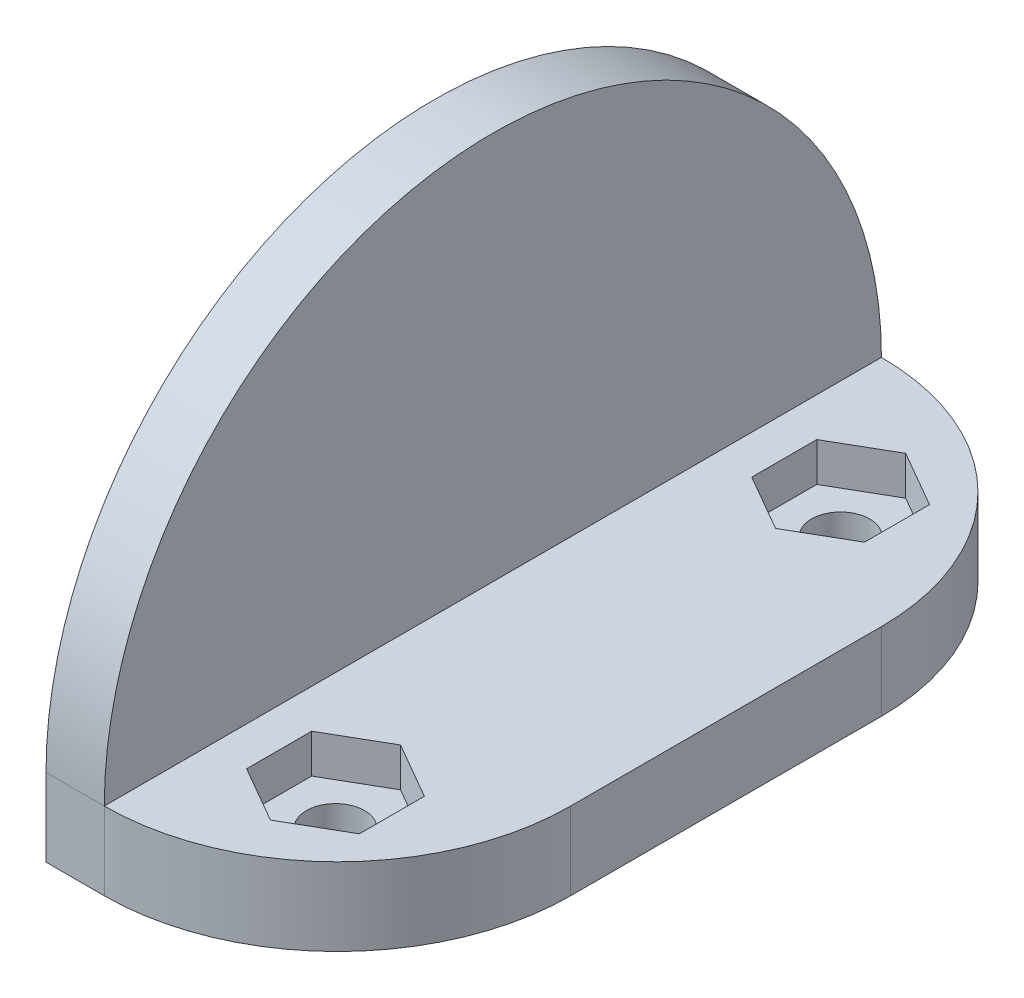
from build123d import *

# Parameters (mm, degrees)
SALIENTE_EXTRUIR1_DEPTH = 40
CORTAR_EXTRUIR4_DEPTH   = 10
CORTAR_EXTRUIR5_DEPTH   = 10
CORTAR_EXTRUIR6_DEPTH   = 2
CROQUIS8_R              = 1.5
CORTAR_EXTRUIR7_DEPTH   = 42
CROQUIS9_R              = 1.5
CORTAR_EXTRUIR8_DEPTH   = 42


with BuildPart() as part:
    # Croquis2 → Saliente-Extruir1 (new body)
    with BuildSketch(Plane.XY):
        Polygon((0, 26), (3, 26), (3, 4), (15, 4), (15, 0), (0, 0), align=None)
    extrude(amount=SALIENTE_EXTRUIR1_DEPTH)

    # Croquis6 → Cortar-Extruir4 (cut)
    with BuildSketch(Plane(origin=(3, 0, 0), x_dir=(0, 0, -1), z_dir=(1, 0, 0))):
        with BuildLine():
            Line((-40, 4), (-43.463242579, 10.305944429))
            Line((-43.463242579, 10.305944429), (-46.103119836, 28.990848346))
            Line((-46.103119836, 28.990848346), (-47.186653475, 36.660038985))
            Line((-47.186653475, 36.660038985), (8.796856155, 26.447825939))
            Line((8.796856155, 26.447825939), (6.381141064, 12.03440645))
            Line((6.381141064, 12.03440645), (0, 4))
            ThreePointArc((0, 4), (-20, 24), (-40, 4))
        make_face()
    extrude(amount=-CORTAR_EXTRUIR4_DEPTH, mode=Mode.SUBTRACT)

    # Croquis5 → Cortar-Extruir5 (cut)
    with BuildSketch(Plane(origin=(0, 4, 0), x_dir=(1, 0, 0), z_dir=(0, 1, 0))):
        with BuildLine():
            Line((15, -12), (15, -28))
            ThreePointArc((15, -28), (11.485281374, -36.485281374), (3, -40))
            Line((3, -40), (17.00840725, -44.81222058))
            Line((17.00840725, -44.81222058), (27.206798155, -5.039954665))
            Line((27.206798155, -5.039954665), (15.87267332, 7.755192399))
            Line((15.87267332, 7.755192399), (3, 0))
            ThreePointArc((3, 0), (11.485281374, -3.514718626), (15, -12))
        make_face()
    extrude(amount=-CORTAR_EXTRUIR5_DEPTH, mode=Mode.SUBTRACT)

    # Croquis7 → Cortar-Extruir6 (cut)
    with BuildSketch(Plane(origin=(0, 4, 0), x_dir=(1, 0, 0), z_dir=(0, 1, 0))):
        Polygon((7.9, -3.651368439), (5, -5.325684219), (5, -8.674315781), (7.9, -10.348631561), (10.8, -8.674315781), (10.8, -5.325684219), align=None)
        Polygon((5, -31.325684219), (5, -34.674315781), (7.9, -36.348631561), (10.8, -34.674315781), (10.8, -31.325684219), (7.9, -29.651368439), align=None)
    extrude(amount=-CORTAR_EXTRUIR6_DEPTH, mode=Mode.SUBTRACT)

    # Croquis8 → Cortar-Extruir7 (cut)
    with BuildSketch(Plane(origin=(0, 2, 0), x_dir=(1, 0, 0), z_dir=(0, 1, 0))):
        with Locations(Location((7.9, -7, 0), (0, 0, 270))):
            Circle(CROQUIS8_R)
    extrude(amount=-CORTAR_EXTRUIR7_DEPTH, mode=Mode.SUBTRACT)

    # Croquis9 → Cortar-Extruir8 (cut)
    with BuildSketch(Plane(origin=(0, 2, 0), x_dir=(1, 0, 0), z_dir=(0, 1, 0))):
        with Locations(Location((7.9, -33, 0), (0, 0, 180))):
            Circle(CROQUIS9_R)
    extrude(amount=-CORTAR_EXTRUIR8_DEPTH, mode=Mode.SUBTRACT)


solid = part.part
